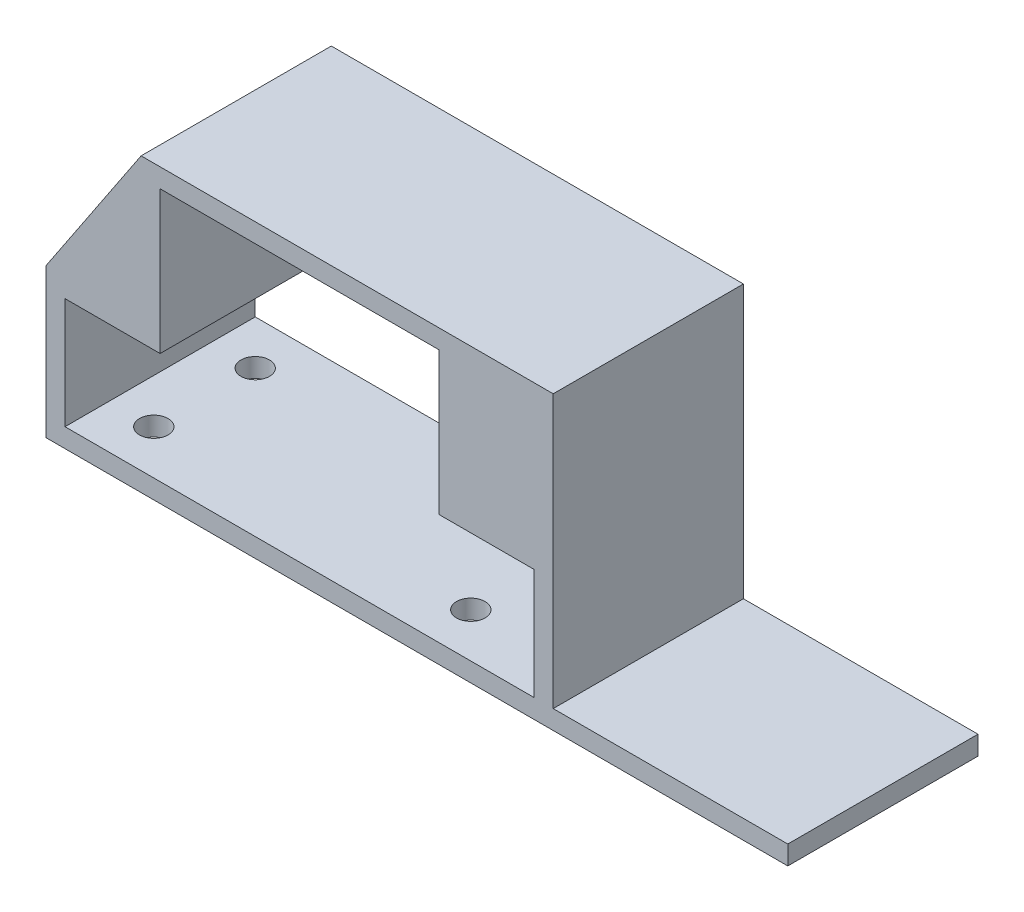
from build123d import *

# Parameters (mm, degrees)
SKETCH1_R           = 2.25
BOSS_EXTRUDE1_DEPTH = 3
BOSS_EXTRUDE2_DEPTH = 30
BOSS_EXTRUDE3_DEPTH = 30


with BuildPart() as part:
    # Sketch1 → Boss-Extrude1 (new body)
    with BuildSketch(Plane(origin=(0, 0, 0), x_dir=(1, 0, 0), z_dir=(0, 1, 0))):
        Polygon((-7, 23), (-7, -7), (57, -7), (107, -7), (107, 23), (57, 23), align=None)
        with Locations(Location((0, 0, 0), (0, 0, 270))):
            Circle(SKETCH1_R, mode=Mode.SUBTRACT)
        with Locations(Location((0, 16, 0), (0, 0, 270))):
            Circle(SKETCH1_R, mode=Mode.SUBTRACT)
        with Locations(Location((50, 0, 0), (0, 0, 270))):
            Circle(SKETCH1_R, mode=Mode.SUBTRACT)
        with Locations(Location((50, 16, 0), (0, 0, 270))):
            Circle(SKETCH1_R, mode=Mode.SUBTRACT)
    extrude(amount=BOSS_EXTRUDE1_DEPTH)

    # Sketch2 → Boss-Extrude2 (add)
    with BuildSketch(Plane(origin=(0, 0, -23), x_dir=(-1, 0, 0), z_dir=(0, 0, -1))):
        Polygon((7, 3), (7, 20.5), (-7.999999932, 20.5), (-7.999999932, 43.000000035), (-51.999999932, 43.000000035), (-51.999999932, 20.5), (-66.999999864, 20.5), (-66.999999864, 3), (-69.999999864, 3), (-69.999999864, 46.000000035), (-4.999999932, 46.000000035), (-4.999999932, 23.5), (10, 23.5), (10, 0), (7, 0), align=None)
    extrude(amount=-BOSS_EXTRUDE2_DEPTH)

    # Sketch3 → Boss-Extrude3 (add)
    with BuildSketch(Plane(origin=(0, 0, -23), x_dir=(-1, 0, 0), z_dir=(0, 0, -1))):
        Polygon((-4.999999932, 46.000000035), (10, 23.5), (-4.999999932, 23.5), align=None)
    extrude(amount=-BOSS_EXTRUDE3_DEPTH)


solid = part.part
